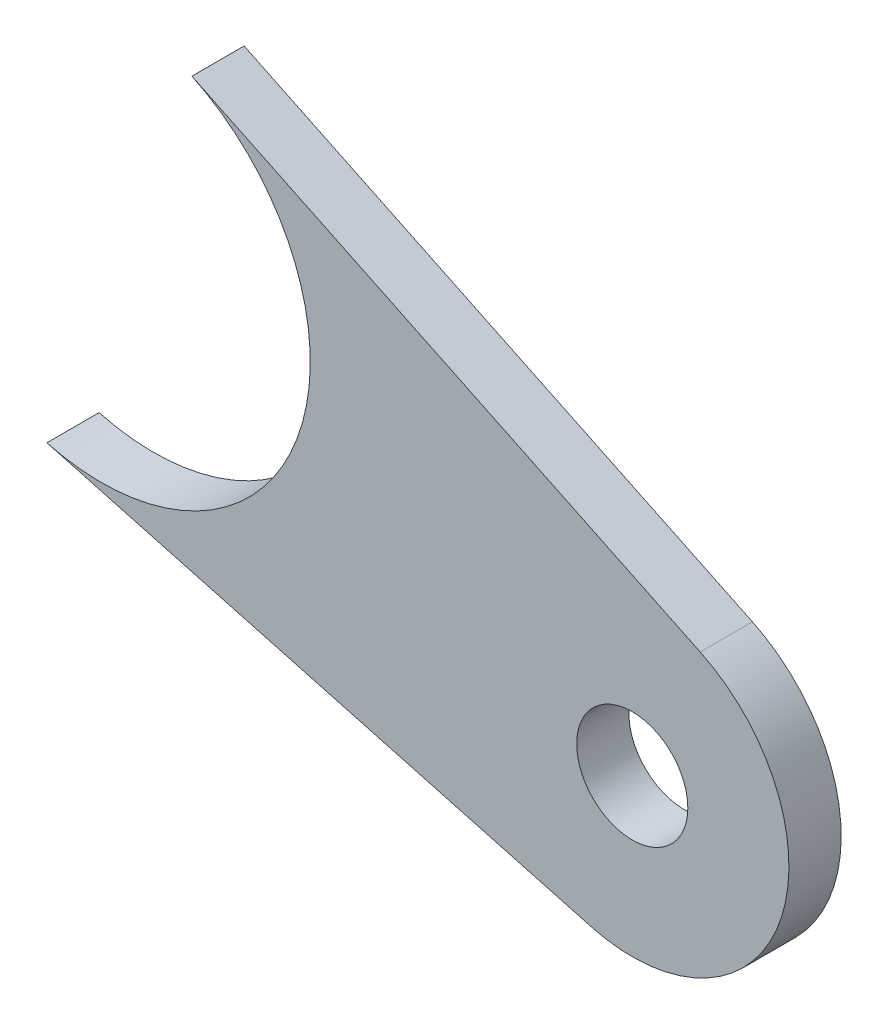
from build123d import *

# Parameters (mm, degrees)
SKETCH1_R           = 3.3782
BOSS_EXTRUDE1_DEPTH = 3.175


with BuildPart() as part:
    # Sketch1 → Boss-Extrude1 (new body)
    with BuildSketch(Plane.XY):
        with BuildLine():
            ThreePointArc((-104.047091932, -9.195763393), (-92.636784441, -3.320028798), (-97.435324623, 8.583474309))
            Line((-97.435324623, 8.583474309), (-128.331370442, 23.446143348))
            ThreePointArc((-128.331370442, 23.446143348), (-121.933316865, 7.574805873), (-137.147060186, -0.259506921))
            Line((-137.147060186, -0.259506921), (-104.047091932, -9.195763393))
        make_face()
        with Locations((-101.56444, 0)):
            Circle(SKETCH1_R, mode=Mode.SUBTRACT)
    extrude(amount=BOSS_EXTRUDE1_DEPTH)


solid = part.part
